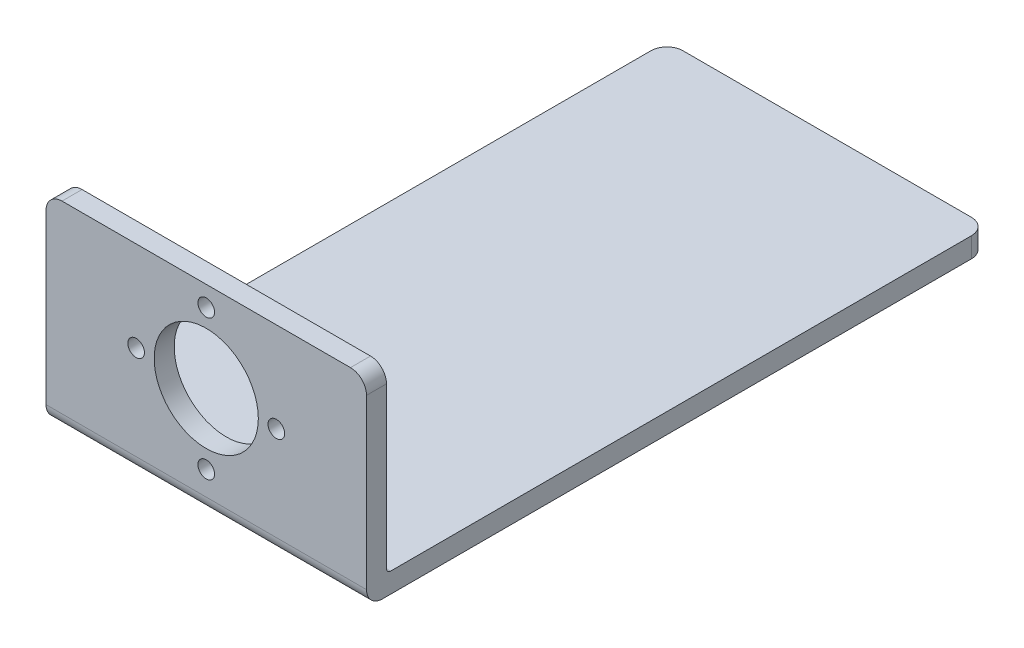
from build123d import *

# Parameters (mm, degrees)
SKETCH1_W                = 80
SKETCH1_H                = 45
SKETCH1_R                = 13
SKETCH1_R_2              = 2.075
BOSS_EXTRUDE1_DEPTH      = 5
BOSS_EXTRUDE2_DEPTH      = 150
BOSS_EXTRUDE2_DEPTH_BACK = 5
SKETCH2_W                = 80
SKETCH2_H                = 5
FILLET1_R                = 4
FILLET2_R                = 1


with BuildPart() as part:
    # Sketch1 → Boss-Extrude1 (new body)
    with BuildSketch(Plane.XY):
        Rectangle(SKETCH1_W, SKETCH1_H)
        Circle(SKETCH1_R, mode=Mode.SUBTRACT)
        with Locations((0, 17.5)):
            Circle(SKETCH1_R_2, mode=Mode.SUBTRACT)
        with Locations((17.5, 0)):
            Circle(SKETCH1_R_2, mode=Mode.SUBTRACT)
        with Locations((0, -17.5)):
            Circle(SKETCH1_R_2, mode=Mode.SUBTRACT)
        with Locations((-17.5, 0)):
            Circle(SKETCH1_R_2, mode=Mode.SUBTRACT)
    extrude(amount=BOSS_EXTRUDE1_DEPTH)

    # Sketch2 → Boss-Extrude2 (add, two sides: drawn at the far end of the back side and taken through both)
    with BuildSketch(Plane(origin=(0, 0, 0), x_dir=(-1, 0, 0), z_dir=(0, 0, -1)).offset(-BOSS_EXTRUDE2_DEPTH_BACK)):
        with Locations((0, -25)):
            Rectangle(SKETCH2_W, SKETCH2_H)
    extrude(amount=BOSS_EXTRUDE2_DEPTH + BOSS_EXTRUDE2_DEPTH_BACK)

    # Fillet1
    fillet1_edges = [part.edges().sort_by_distance(p)[0] for p in [
        (0, -27.5, 5),
        (40, -25, -150),
        (-40, -25, -150),
        (-40, 22.5, 2.5),
        (40, 22.5, 2.5),
    ]]
    fillet(fillet1_edges, radius=FILLET1_R)

    # Fillet2
    fillet2_edges = [part.edges().sort_by_distance(p)[0] for p in [
        (0, -22.5, 0),
    ]]
    fillet(fillet2_edges, radius=FILLET2_R)


solid = part.part
